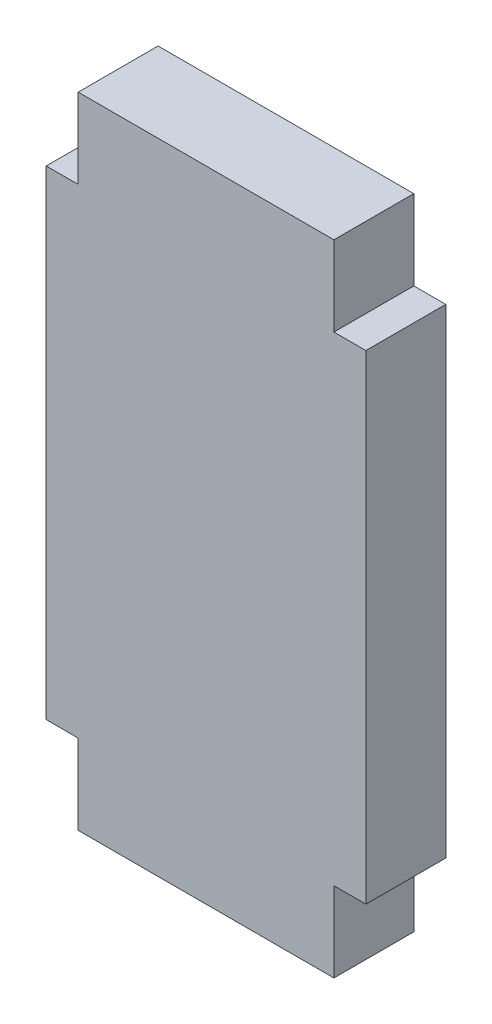
from build123d import *

# Parameters (mm, degrees)
BOSS_EXTRUDE1_DEPTH = 5


with BuildPart() as part:
    # Sketch1 → Boss-Extrude1 (new body)
    with BuildSketch(Plane.XY):
        Polygon((-8, -15), (-10, -15), (-10, 15), (-8, 15), (-8, 20), (8, 20), (8, 15), (10, 15), (10, -15), (8, -15), (8, -20), (-8, -20), align=None)
    extrude(amount=BOSS_EXTRUDE1_DEPTH)


solid = part.part
